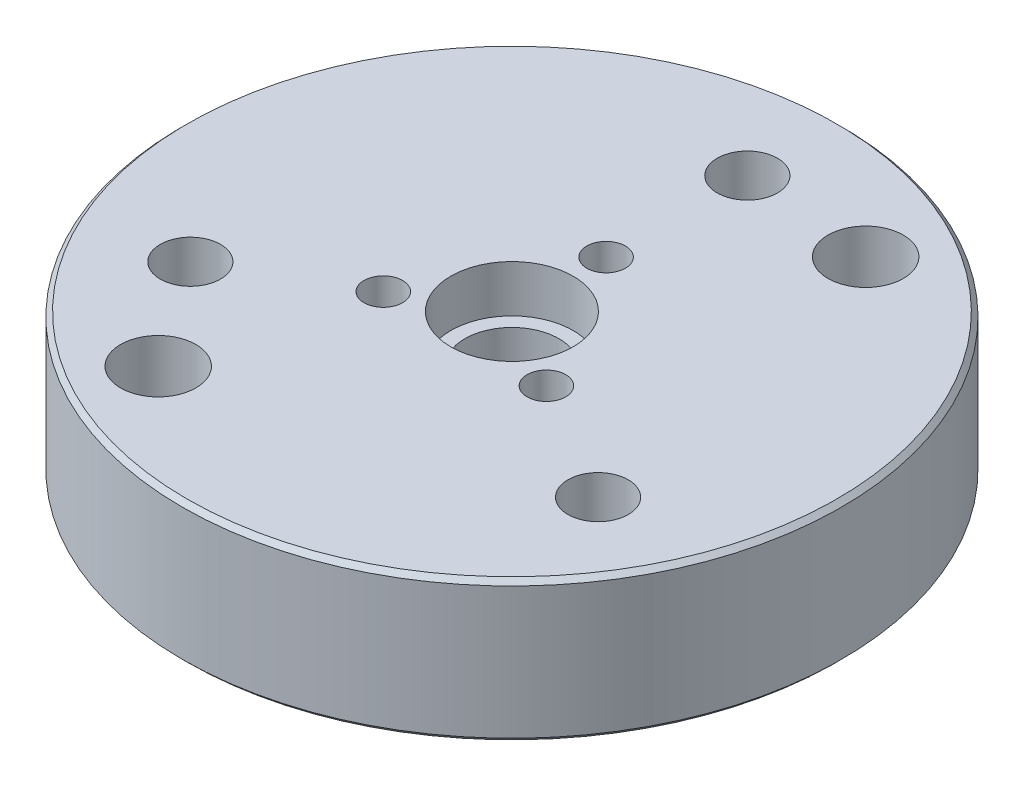
from build123d import *

# Parameters (mm, degrees)
SKETCH1_R             = 35
BOSS_EXTRUDE1_DEPTH   = 15
CUT_EXTRUDE1_REACH    = 53.72
SKETCH2_R             = 5
SKETCH3_R             = 6.5
CUT_EXTRUDE2_DEPTH    = 5
CUT_EXTRUDE3_REACH    = 53.72
SKETCH4_R             = 2.05
M6_CLEARANCE_HOLE1_D  = 6.4
F_8_0MM_DOWEL_HOLE1_D = 8
CHAMFER1_SIZE         = 0.5


with BuildPart() as part:
    # Sketch1 → Boss-Extrude1 (new body)
    with BuildSketch(Plane(origin=(0, 0, 0), x_dir=(1, 0, 0), z_dir=(0, 1, 0))):
        with Locations(Location((0, 0, 0), (0, 0, 270))):
            Circle(SKETCH1_R)
    extrude(amount=BOSS_EXTRUDE1_DEPTH)

    # Sketch2 → Cut-Extrude1 (cut, up to next)
    with BuildSketch(Plane(origin=(0, 15, 0), x_dir=(1, 0, 0), z_dir=(0, 1, 0)), mode=Mode.PRIVATE) as cut_extrude1_sk1:
        with Locations(Location((0, 0, 0), (0, 0, 270))):
            Circle(SKETCH2_R)
    cut_extrude1_tool1 = extrude(cut_extrude1_sk1.sketch, amount=-CUT_EXTRUDE1_REACH, mode=Mode.PRIVATE) & part.part
    add(cut_extrude1_tool1.solids().sort_by_distance((0, 15, 0))[0], mode=Mode.SUBTRACT)

    # Sketch3 → Cut-Extrude2 (cut)
    with BuildSketch(Plane(origin=(0, 15, 0), x_dir=(1, 0, 0), z_dir=(0, 1, 0))):
        with Locations(Location((0, 0, 0), (0, 0, 270))):
            Circle(SKETCH3_R)
    extrude(amount=-CUT_EXTRUDE2_DEPTH, mode=Mode.SUBTRACT)

    # Sketch4 → Cut-Extrude3 (cut, up to next)
    with BuildSketch(Plane(origin=(0, 15, 0), x_dir=(1, 0, 0), z_dir=(0, 1, 0)), mode=Mode.PRIVATE) as cut_extrude3_sk1:
        with Locations(Location((0, 10, 0), (0, 0, 270))):
            Circle(SKETCH4_R)
    cut_extrude3_tool1 = extrude(cut_extrude3_sk1.sketch, amount=-CUT_EXTRUDE3_REACH, mode=Mode.PRIVATE) & part.part
    # Sketch4 → Cut-Extrude3 (cut, up to next)
    with BuildSketch(Plane(origin=(0, 15, 0), x_dir=(1, 0, 0), z_dir=(0, 1, 0)), mode=Mode.PRIVATE) as cut_extrude3_sk2:
        with Locations(Location((8.660254038, -5, 0), (0, 0, 270))):
            Circle(SKETCH4_R)
    cut_extrude3_tool2 = extrude(cut_extrude3_sk2.sketch, amount=-CUT_EXTRUDE3_REACH, mode=Mode.PRIVATE) & part.part
    # Sketch4 → Cut-Extrude3 (cut, up to next)
    with BuildSketch(Plane(origin=(0, 15, 0), x_dir=(1, 0, 0), z_dir=(0, 1, 0)), mode=Mode.PRIVATE) as cut_extrude3_sk3:
        with Locations(Location((-8.660254038, -5, 0), (0, 0, 270))):
            Circle(SKETCH4_R)
    cut_extrude3_tool3 = extrude(cut_extrude3_sk3.sketch, amount=-CUT_EXTRUDE3_REACH, mode=Mode.PRIVATE) & part.part
    add(cut_extrude3_tool1.solids().sort_by_distance((0, 15, -10))[0], mode=Mode.SUBTRACT)
    add(cut_extrude3_tool2.solids().sort_by_distance((8.660254, 15, 5))[0], mode=Mode.SUBTRACT)
    add(cut_extrude3_tool3.solids().sort_by_distance((-8.660254, 15, 5))[0], mode=Mode.SUBTRACT)

    # M6 Clearance Hole1 (through all)
    with Locations(Plane(origin=(0, 0, 0), x_dir=(-1, 0, 0), z_dir=(0, -1, 0))):
        with Locations((0, 25), (21.650635095, -12.5), (-21.650635095, -12.5)):
            Hole(M6_CLEARANCE_HOLE1_D / 2)

    # Ø8.0mm Dowel Hole1 (through all)
    with Locations(Plane(origin=(0, 0, 0), x_dir=(-1, 0, 0), z_dir=(0, -1, 0))):
        with Locations((-13.75, 23.815698604), (13.75, -23.815698604)):
            Hole(F_8_0MM_DOWEL_HOLE1_D / 2)

    # Chamfer1
    chamfer1_edges = [part.edges().sort_by_distance(p)[0] for p in [
        (0, 0, -35),
        (0, 15, -35),
    ]]
    chamfer(chamfer1_edges, length=CHAMFER1_SIZE)


solid = part.part
